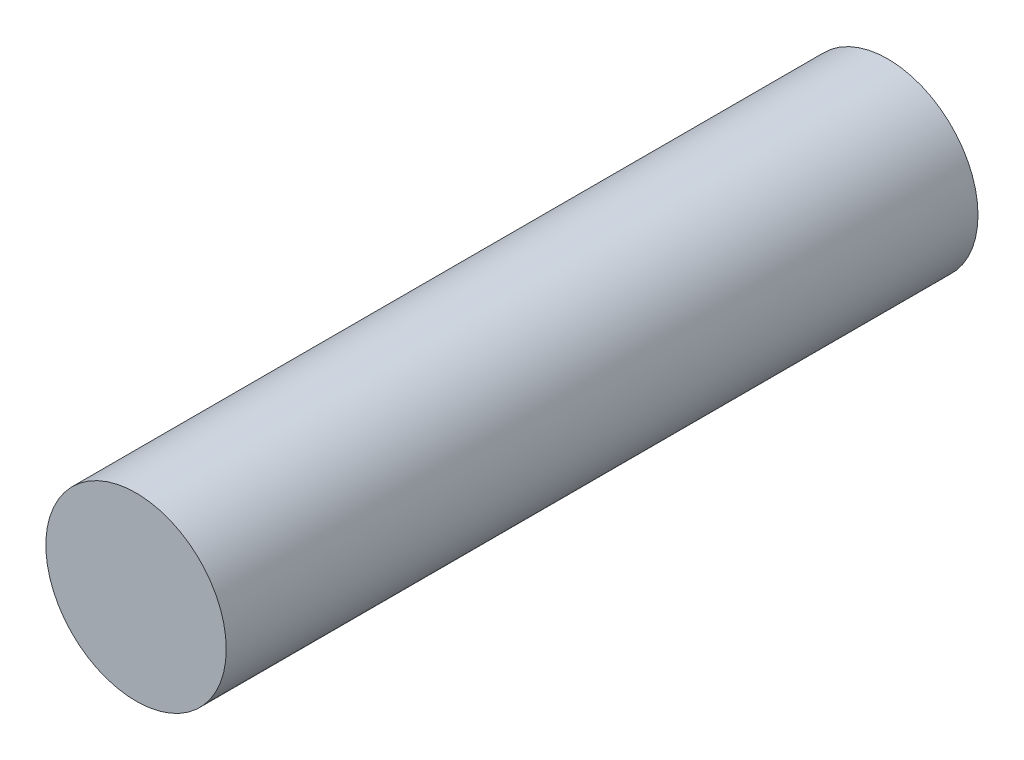
from build123d import *

# Parameters (mm, degrees)
SKETCH1_R           = 2.5
BOSS_EXTRUDE1_DEPTH = 10
MOVE_FACE1_BY       = 0.1


with BuildPart() as part:
    # Sketch1 → Boss-Extrude1 (new, symmetric)
    with BuildSketch(Plane.XY):
        Circle(SKETCH1_R)
    extrude(amount=BOSS_EXTRUDE1_DEPTH, both=True)

    # Move Face1: a curved face moved inward by 0.1
    add(Solid.thicken(part.faces().sort_by_distance((-2.5, 0, 0))[0], -MOVE_FACE1_BY), mode=Mode.SUBTRACT)


solid = part.part
